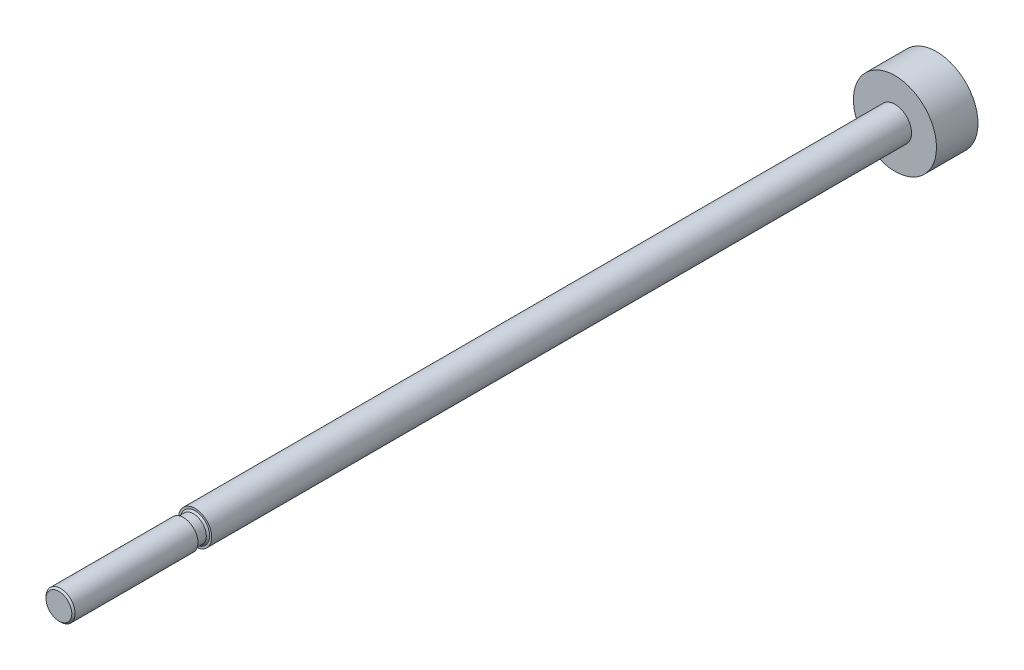
from build123d import *

# Parameters (mm, degrees)
SKETCH1_R          = 2
BASE_EXTRUDE_DEPTH = 103.185
SKETCH2_R          = 5
PISTON_DEPTH       = 2.5


with BuildPart() as part:
    # Sketch1 → Base-Extrude (new body)
    with BuildSketch(Plane.XY):
        with Locations(Location((0, 0, 0), (0, 0, 180))):
            Circle(SKETCH1_R)
    extrude(amount=BASE_EXTRUDE_DEPTH)

    # Sketch2 → Piston (add, symmetric)
    with BuildSketch(Plane.XY):
        Circle(SKETCH2_R)
    extrude(amount=PISTON_DEPTH, both=True)

    # Sketch3 → Threads (revolve, cut)
    with BuildSketch(Plane(origin=(0, 0, 0), x_dir=(0, 0, -1), z_dir=(1, 0, 0)), mode=Mode.PRIVATE) as threads_sk:
        Polygon((-103.185, 1.5525), (-102.985, 1.7525), (-88.185, 1.7525), (-88.185, 1.55), (-86.985, 1.55), (-86.785, 1.75), (-86.785, 5), (-103.185, 5), align=None)
    revolve(threads_sk.sketch.rotate(Axis((0, 0, 0), (0, 0, 1)), 90), axis=Axis((0, 0, 0), (0, 0, 1)), mode=Mode.SUBTRACT)


solid = part.part
